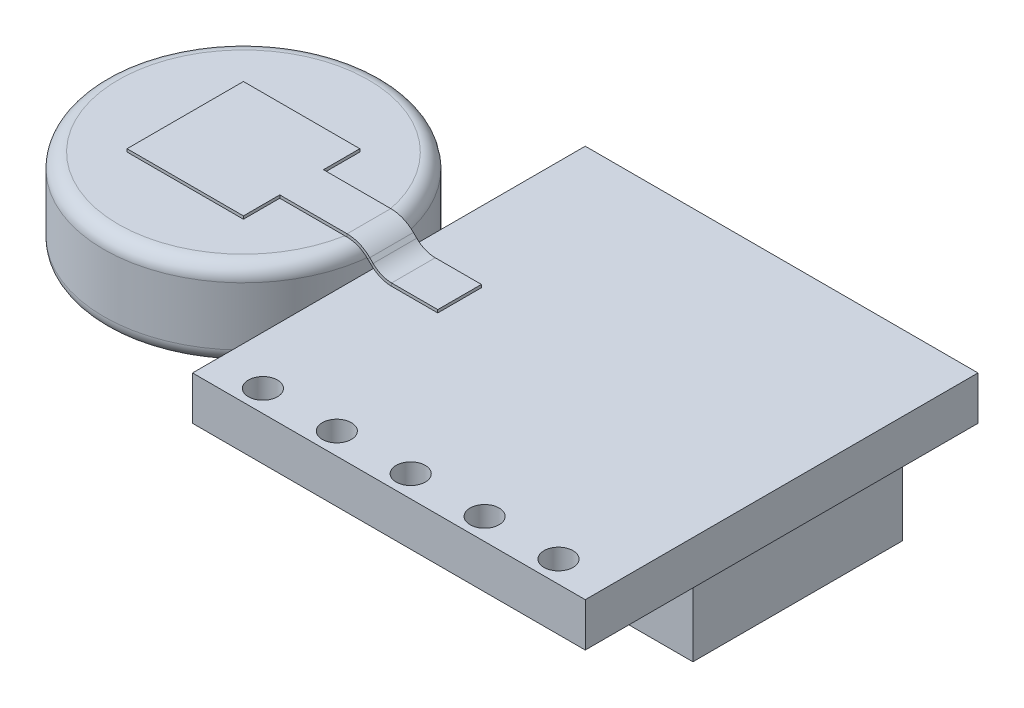
from build123d import *

# Parameters (mm, degrees)
SKETCH1_W           = 13.5
SKETCH1_H           = 13.5
BOSS_EXTRUDE1_DEPTH = 1.5
SKETCH2_R           = 0.5
CUT_EXTRUDE1_DEPTH  = 1.5
SKETCH3_R           = 4.8
BOSS_EXTRUDE2_DEPTH = 0.8
SKETCH4_R           = 4.8
BOSS_EXTRUDE3_DEPTH = 2.2
FILLET1_R           = 0.5
SKETCH5_W           = 10.4
SKETCH5_H           = 7.2
BOSS_EXTRUDE4_DEPTH = 2.7
SKETCH7_W           = 1.5
SKETCH7_H           = 0.1
SKETCH8_W           = 4
SKETCH8_H           = 0.1
BOSS_EXTRUDE5_DEPTH = 4


with BuildPart() as part:
    # Sketch1 → Boss-Extrude1 (new body)
    with BuildSketch(Plane(origin=(0, 0, 0), x_dir=(1, 0, 0), z_dir=(0, 1, 0))):
        with Locations((6.75, 6.75)):
            Rectangle(SKETCH1_W, SKETCH1_H)
    extrude(amount=BOSS_EXTRUDE1_DEPTH)

    # Sketch2 → Cut-Extrude1 (cut)
    with BuildSketch(Plane(origin=(0, 1.5, 0), x_dir=(1, 0, 0), z_dir=(0, 1, 0))):
        with Locations(Location((11.83, 0.75, 0), (0, 0, 270))):
            Circle(SKETCH2_R)
        with Locations(Location((9.29, 0.75, 0), (0, 0, 270))):
            Circle(SKETCH2_R)
        with Locations(Location((6.75, 0.75, 0), (0, 0, 270))):
            Circle(SKETCH2_R)
        with Locations(Location((4.21, 0.75, 0), (0, 0, 270))):
            Circle(SKETCH2_R)
        with Locations(Location((1.67, 0.75, 0), (0, 0, 270))):
            Circle(SKETCH2_R)
    extrude(amount=-CUT_EXTRUDE1_DEPTH, mode=Mode.SUBTRACT)

    # Sketch5 → Boss-Extrude4 (add)
    with BuildSketch(Plane.XZ):
        with Locations((7.8, -7.8)):
            Rectangle(SKETCH5_W, SKETCH5_H)
    extrude(amount=BOSS_EXTRUDE4_DEPTH)



with BuildPart() as body_2:
    # Sketch3 → Boss-Extrude2 (new body)
    with BuildSketch(Plane(origin=(0, 0, 0), x_dir=(1, 0, 0), z_dir=(0, 1, 0))):
        with Locations(Location((-5, 6.75, 0), (0, 0, 270))):
            Circle(SKETCH3_R)
    extrude(amount=-BOSS_EXTRUDE2_DEPTH)

    # Sketch4 → Boss-Extrude3 (add)
    with BuildSketch(Plane(origin=(0, 0, 0), x_dir=(1, 0, 0), z_dir=(0, 1, 0))):
        with Locations(Location((-5, 6.75, 0), (0, 0, 270))):
            Circle(SKETCH4_R)
    extrude(amount=BOSS_EXTRUDE3_DEPTH)

    # Fillet1
    fillet1_edges = [body_2.edges().sort_by_distance(p)[0] for p in [
        (-5, -0.8, -11.55),
        (-5, 2.2, -11.55),
    ]]
    fillet(fillet1_edges, radius=FILLET1_R)


with BuildPart() as part_1:
    add(part.part)

    add(body_2.part)  # Sweep1 merges body 2
    # Sweep1: sweep along a path in Sketch6
    with BuildLine(Plane.XY.offset(-6.75)) as sweep1_path:
        Line((-3, 2.2), (-0.684692448, 2.2))
        ThreePointArc((-0.684692448, 2.2), (-0.302009016, 2.123879533), (0.022414333, 1.907106781))
        Line((0.022414333, 1.907106781), (0.136627895, 1.792893219))
        ThreePointArc((0.136627895, 1.792893219), (0.461051244, 1.576120467), (0.843734676, 1.5))
        Line((0.843734676, 1.5), (2.429521114, 1.5))
    # Sketch7 → Sweep1 (sweep)
    with BuildSketch(Plane(origin=(-3, 0, 0), x_dir=(0, 0, -1), z_dir=(1, 0, 0))):
        with Locations((6.75, 2.25)):
            Rectangle(SKETCH7_W, SKETCH7_H)
    sweep(path=sweep1_path.line)

    # Sketch8 → Boss-Extrude5 (add)
    with BuildSketch(Plane(origin=(-3, 0, 0), x_dir=(0, 0, -1), z_dir=(1, 0, 0))):
        with Locations((6.75, 2.25)):
            Rectangle(SKETCH8_W, SKETCH8_H)
    extrude(amount=-BOSS_EXTRUDE5_DEPTH)


solid = part_1.part
